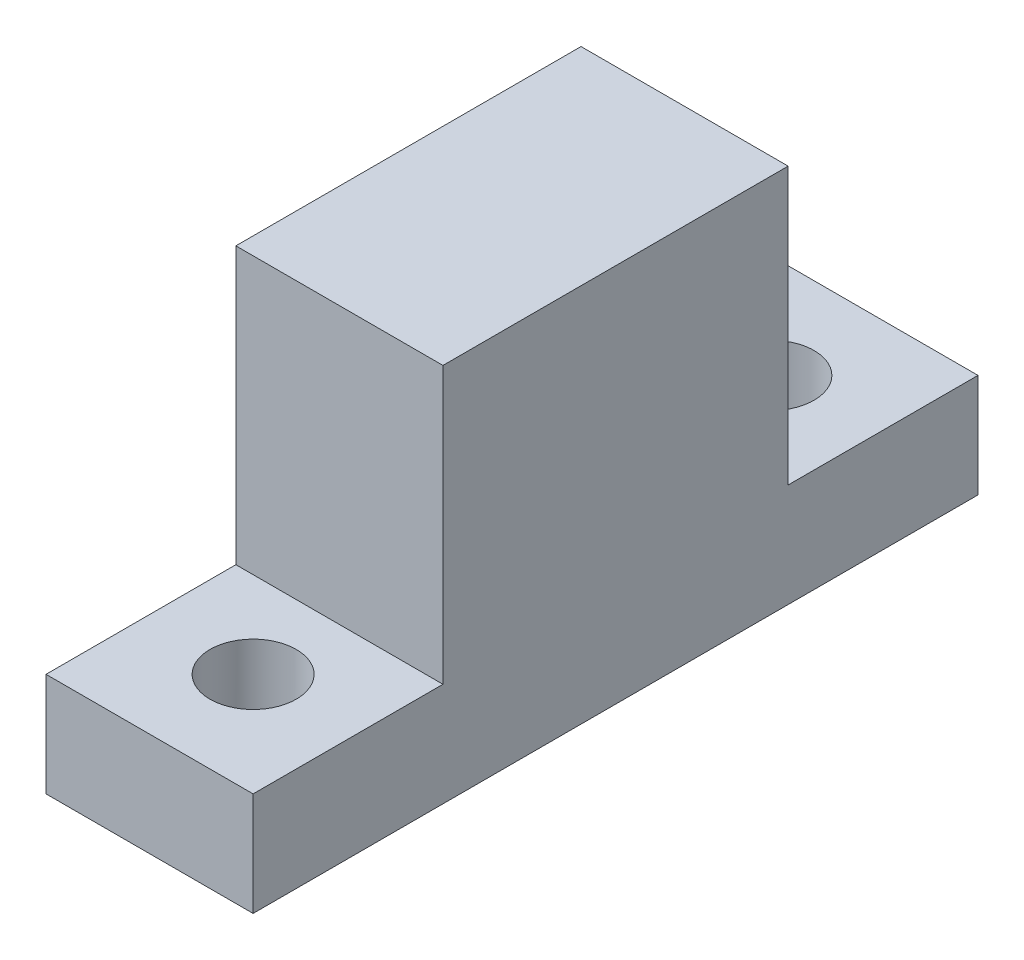
from build123d import *

# Parameters (mm, degrees)
SKETCH2_W           = 6
SKETCH2_H           = 21
BOSS_EXTRUDE1_DEPTH = 3
SKETCH3_W           = 6
SKETCH3_H           = 10
BOSS_EXTRUDE2_DEPTH = 8
SKETCH4_R           = 1.25
CUT_EXTRUDE1_DEPTH  = 6
SKETCH5_R           = 1.25
CUT_EXTRUDE2_DEPTH  = 6


with BuildPart() as part:
    # Sketch2 → Boss-Extrude1 (new body)
    with BuildSketch(Plane(origin=(0, 0, 0), x_dir=(1, 0, 0), z_dir=(0, 1, 0))):
        with Locations((3, 10.5)):
            Rectangle(SKETCH2_W, SKETCH2_H)
    extrude(amount=BOSS_EXTRUDE1_DEPTH)

    # Sketch3 → Boss-Extrude2 (add)
    with BuildSketch(Plane(origin=(0, 3, 0), x_dir=(1, 0, 0), z_dir=(0, 1, 0))):
        with Locations((3, 10.5)):
            Rectangle(SKETCH3_W, SKETCH3_H)
    extrude(amount=BOSS_EXTRUDE2_DEPTH)

    # Sketch4 → Cut-Extrude1 (cut)
    with BuildSketch(Plane(origin=(0, 3, 0), x_dir=(1, 0, 0), z_dir=(0, 1, 0))):
        with Locations(Location((3, 18, 0), (0, 0, 270))):
            Circle(SKETCH4_R)
    extrude(amount=-CUT_EXTRUDE1_DEPTH, mode=Mode.SUBTRACT)

    # Sketch5 → Cut-Extrude2 (cut)
    with BuildSketch(Plane(origin=(0, 3, 0), x_dir=(1, 0, 0), z_dir=(0, 1, 0))):
        with Locations(Location((3, 3, 0), (0, 0, 270))):
            Circle(SKETCH5_R)
    extrude(amount=-CUT_EXTRUDE2_DEPTH, mode=Mode.SUBTRACT)


solid = part.part
